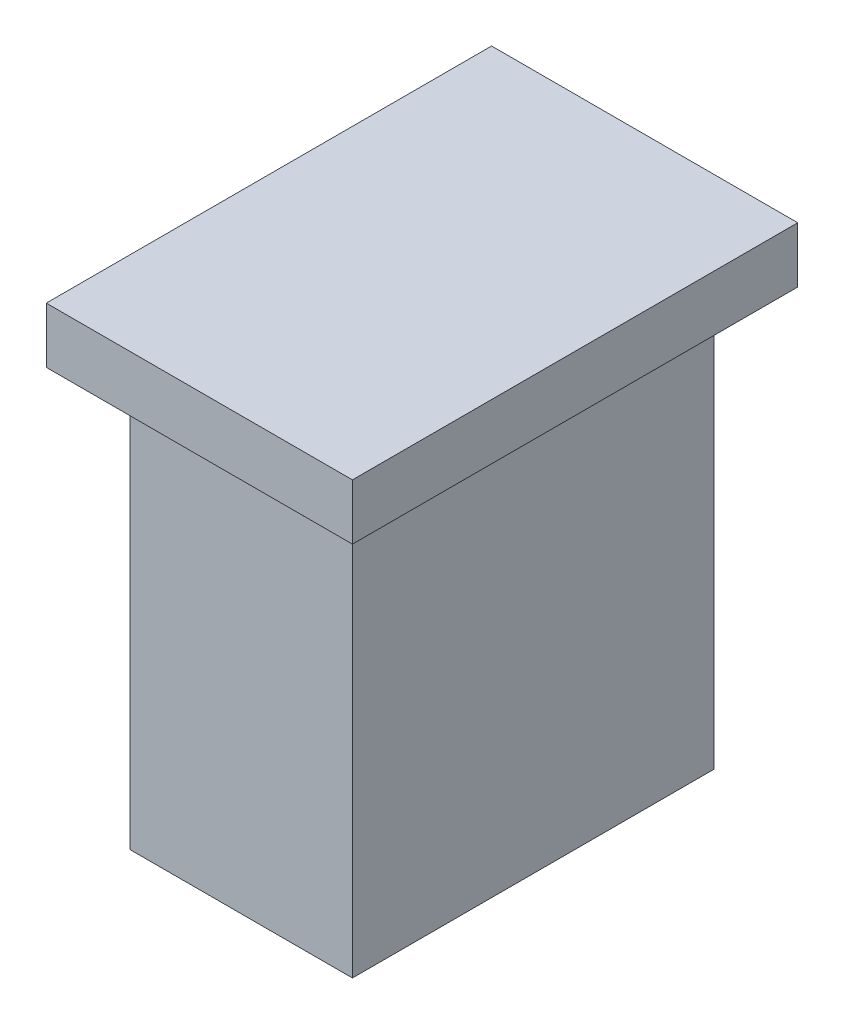
from build123d import *

# Parameters (mm, degrees)
SKETCH_1_W      = 8
SKETCH_1_H      = 13
EXTRUDE_1_DEPTH = 15
SKETCH_2_W      = 11
SKETCH_2_H      = 16
EXTRUDE_2_DEPTH = 2


with BuildPart() as part:
    # Эскиз1 → Бобышка-Вытянуть1 (new body)
    with BuildSketch(Plane(origin=(0, 0, 0), x_dir=(1, 0, 0), z_dir=(0, 1, 0))):
        Rectangle(SKETCH_1_W, SKETCH_1_H)
    extrude(amount=EXTRUDE_1_DEPTH)

    # Эскиз2 → Бобышка-Вытянуть2 (add)
    with BuildSketch(Plane(origin=(0, 15, 0), x_dir=(1, 0, 0), z_dir=(0, 1, 0))):
        Rectangle(SKETCH_2_W, SKETCH_2_H)
    extrude(amount=EXTRUDE_2_DEPTH)


solid = part.part
